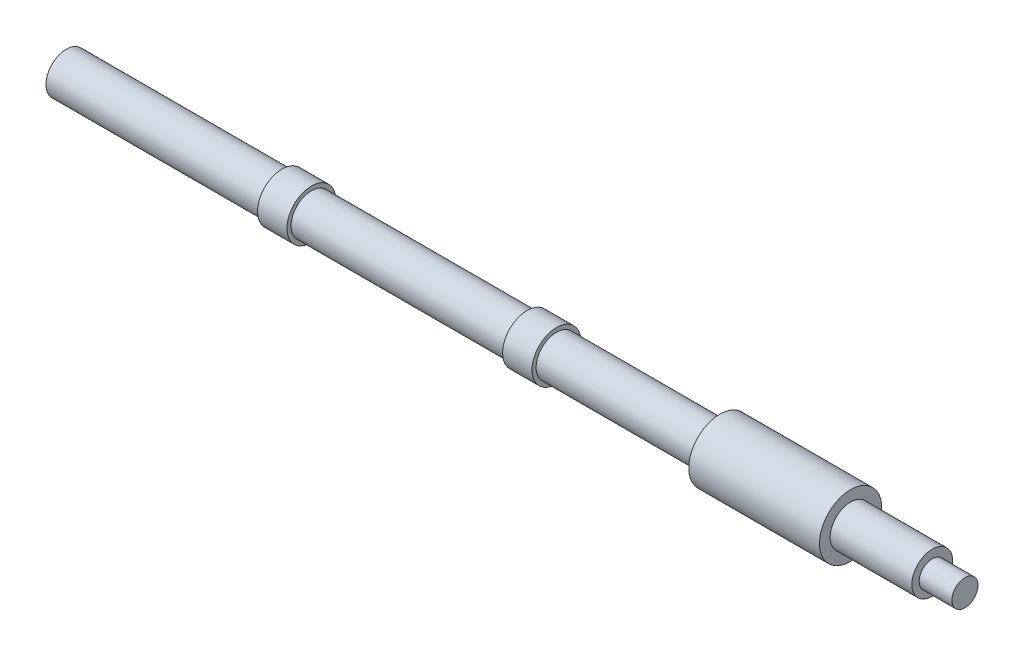
from build123d import *

# Parameters (mm, degrees)
EXTRUDE_1_DEPTH      = 100
EXTRUDE_1_DEPTH_BACK = 50
SKETCH_1_R           = 12.5
SKETCH_2_R           = 15
EXTRUDE_2_DEPTH      = 18
SKETCH_3_R           = 12.5
EXTRUDE_3_DEPTH      = 132
EXTRUDE_START        = 18
SKETCH_4_R           = 15
EXTRUDE_4_DEPTH      = 18
SKETCH_5_R           = 12.5
EXTRUDE_5_DEPTH      = 100
SKETCH_6_R           = 19.05
EXTRUDE_6_DEPTH      = 80
SKETCH_7_R           = 12.5
EXTRUDE_7_DEPTH      = 50
SKETCH_9_R           = 8
EXTRUDE_8_DEPTH      = 20


with BuildPart() as part:
    # 草图1 → 凸台-拉伸1 (new, two sides: drawn at the far end of the back side and taken through both)
    with BuildSketch(Plane(origin=(0, 0, 0), x_dir=(0, 0, -1), z_dir=(1, 0, 0)).offset(-EXTRUDE_1_DEPTH_BACK)):
        Circle(SKETCH_1_R)
    extrude(amount=EXTRUDE_1_DEPTH + EXTRUDE_1_DEPTH_BACK)

    # 草图2 → 凸台-拉伸2 (add)
    with BuildSketch(Plane(origin=(100, 0, 0), x_dir=(0, 0, -1), z_dir=(1, 0, 0))):
        Circle(SKETCH_2_R)
    extrude(amount=-EXTRUDE_2_DEPTH)

    # 草图3 → 凸台-拉伸3 (add)
    with BuildSketch(Plane(origin=(100, 0, 0), x_dir=(0, 0, -1), z_dir=(1, 0, 0))):
        Circle(SKETCH_3_R)
    extrude(amount=EXTRUDE_3_DEPTH)

    # 草图4 → 凸台-拉伸4 (add)
    with BuildSketch(Plane(origin=(232, 0, 0), x_dir=(0, 0, -1), z_dir=(1, 0, 0)).offset(EXTRUDE_START)):
        Circle(SKETCH_4_R)
    extrude(amount=-EXTRUDE_4_DEPTH)

    # 草图5 → 凸台-拉伸5 (add)
    with BuildSketch(Plane(origin=(250, 0, 0), x_dir=(0, 0, -1), z_dir=(1, 0, 0))):
        Circle(SKETCH_5_R)
    extrude(amount=EXTRUDE_5_DEPTH)

    # 草图6 → 凸台-拉伸6 (add)
    with BuildSketch(Plane(origin=(350, 0, 0), x_dir=(0, 0, -1), z_dir=(1, 0, 0))):
        Circle(SKETCH_6_R)
    extrude(amount=EXTRUDE_6_DEPTH)

    # 草图7 → 凸台-拉伸7 (add)
    with BuildSketch(Plane(origin=(430, 0, 0), x_dir=(0, 0, -1), z_dir=(1, 0, 0))):
        Circle(SKETCH_7_R)
    extrude(amount=EXTRUDE_7_DEPTH)

    # 草图9 → 凸台-拉伸8 (add)
    with BuildSketch(Plane(origin=(480, 0, 0), x_dir=(0, 0, -1), z_dir=(1, 0, 0))):
        with Locations((0, -0.60565557)):
            Circle(SKETCH_9_R)
    extrude(amount=EXTRUDE_8_DEPTH)


solid = part.part
